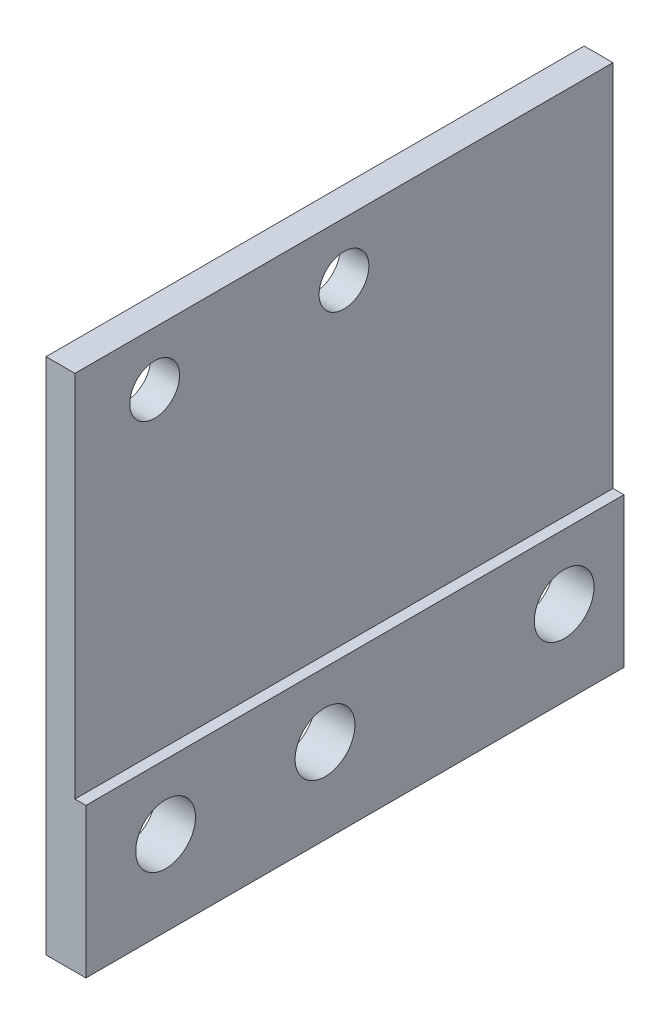
from build123d import *

# Parameters (mm, degrees)
BOSS_EXTRUDE1_DEPTH            = 22
BOSS_EXTRUDE1_DEPTH_BACK       = 5
TAP_DRILL_FOR_M3X0_5_TAP1_D    = 3
TAP_DRILL_FOR_M2_5X0_45_TAP1_D = 2.5


with BuildPart() as part:
    # Sketch1 → Boss-Extrude1 (new, two sides: drawn at the far end of the back side and taken through both)
    with BuildSketch(Plane.XY.offset(-BOSS_EXTRUDE1_DEPTH_BACK)):
        Polygon((0, 0), (2, 0), (2, 7.5), (1.45, 7.5), (1.45, 26), (0, 26), (0, 7.5), align=None)
    extrude(amount=BOSS_EXTRUDE1_DEPTH + BOSS_EXTRUDE1_DEPTH_BACK)

    # Tap Drill for M3x0.5 Tap1 (through all)
    with Locations(Plane(origin=(2, 0, 0), x_dir=(0, 0, -1), z_dir=(1, 0, 0))):
        with Locations((-10, 4.25), (-18, 4.25), (2, 4.25)):
            Hole(TAP_DRILL_FOR_M3X0_5_TAP1_D / 2)

    # Tap Drill for M2.5x0.45 Tap1 (through all)
    with Locations(Plane(origin=(1.45, 0, 0), x_dir=(0, 0, -1), z_dir=(1, 0, 0))):
        with Locations((-18, 23.297203827), (-8.5, 23.297203827)):
            Hole(TAP_DRILL_FOR_M2_5X0_45_TAP1_D / 2)


solid = part.part
